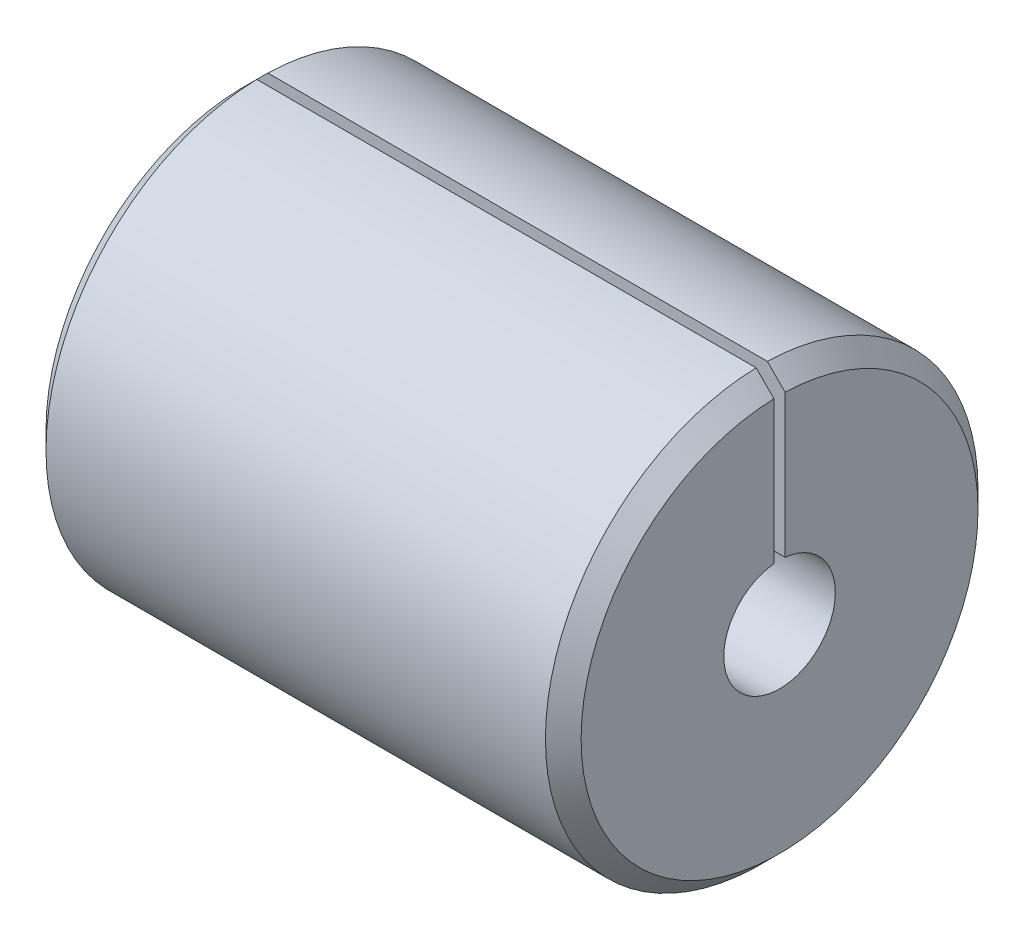
from build123d import *

# Parameters (mm, degrees)
SKETCH1_R           = 9.7
BOSS_EXTRUDE1_DEPTH = 24
SKETCH2_R           = 2.5
CUT_EXTRUDE1_DEPTH  = 28.643805816
SKETCH3_W           = 0.5
SKETCH3_H           = 19.4
CUT_EXTRUDE2_DEPTH  = 28.643805816
CHAMFER1_SIZE       = 0.8


with BuildPart() as part:
    # Sketch1 → Boss-Extrude1 (new body)
    with BuildSketch(Plane(origin=(0, 0, 0), x_dir=(0, 0, -1), z_dir=(1, 0, 0))):
        Circle(SKETCH1_R)
    extrude(amount=BOSS_EXTRUDE1_DEPTH)

    # Sketch2 → Cut-Extrude1 (cut, through all)
    with BuildSketch(Plane(origin=(24, 0, 0), x_dir=(0, 0, -1), z_dir=(1, 0, 0))):
        Circle(SKETCH2_R)
    extrude(amount=-CUT_EXTRUDE1_DEPTH, mode=Mode.SUBTRACT)

    # Sketch3 → Cut-Extrude2 (cut, through all)
    with BuildSketch(Plane.ZY):
        with Locations((0, 9.7)):
            Rectangle(SKETCH3_W, SKETCH3_H)
    extrude(amount=-CUT_EXTRUDE2_DEPTH, mode=Mode.SUBTRACT)

    # Chamfer1
    chamfer1_edges = [part.edges().sort_by_distance(p)[0] for p in [
        (0, -6.946761836, 6.769970458),
        (24, -6.946761836, 6.769970458),
    ]]
    chamfer(chamfer1_edges, length=CHAMFER1_SIZE)


solid = part.part
